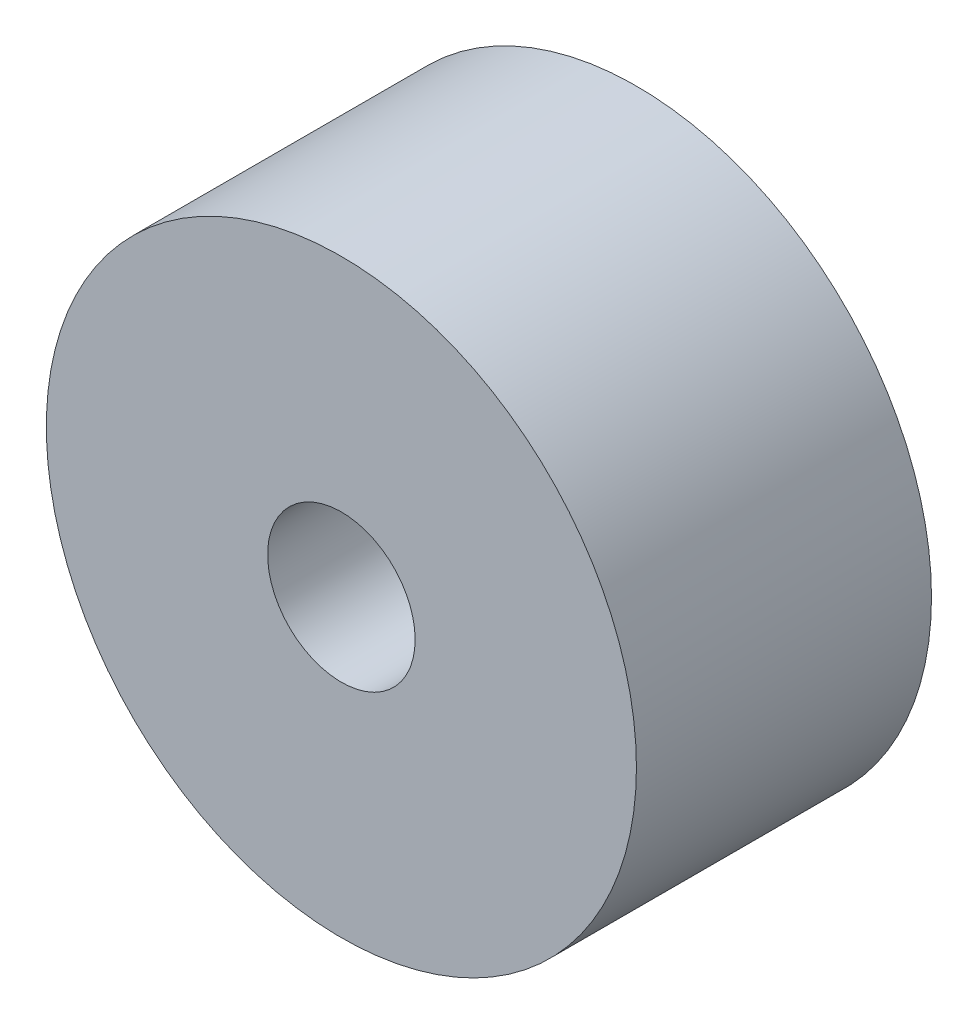
from build123d import *

# Parameters (mm, degrees)
SKETCH1_R           = 10
SKETCH1_R_2         = 2.5
BOSS_EXTRUDE1_DEPTH = 5


with BuildPart() as part:
    # Sketch1 → Boss-Extrude1 (new, symmetric)
    with BuildSketch(Plane.XY):
        Circle(SKETCH1_R)
        Circle(SKETCH1_R_2, mode=Mode.SUBTRACT)
    extrude(amount=BOSS_EXTRUDE1_DEPTH, both=True)


solid = part.part
